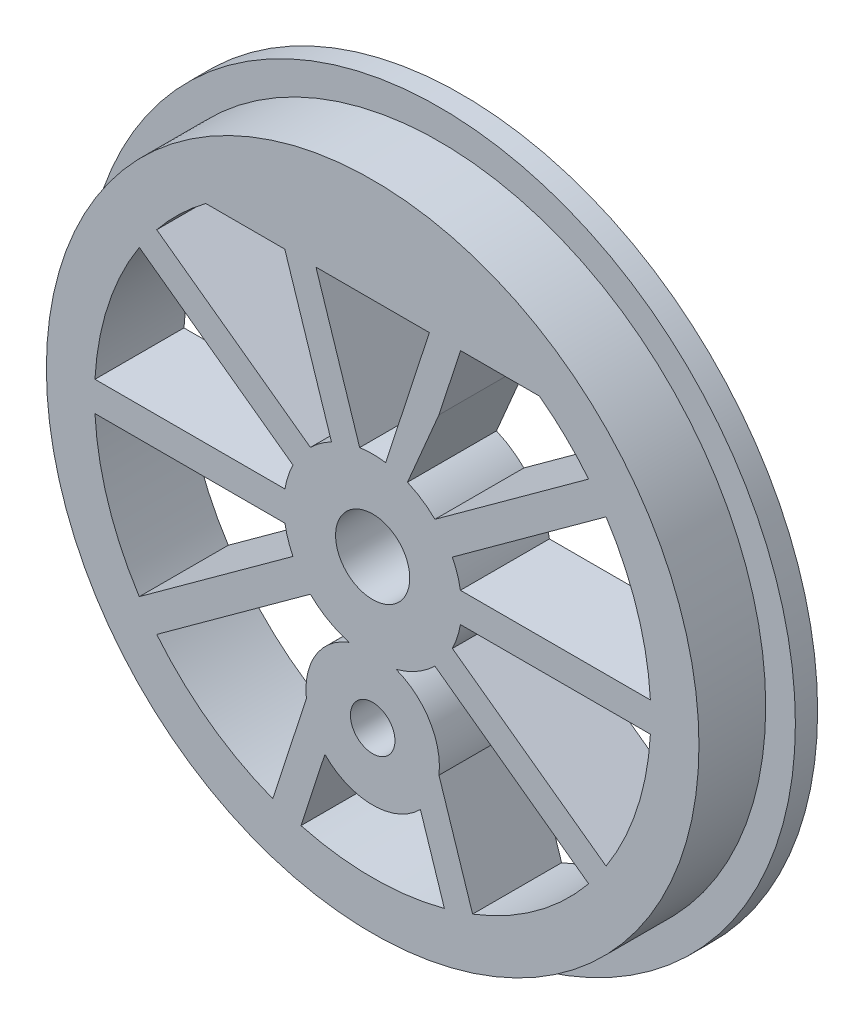
from build123d import *

# Parameters (mm, degrees)
ESQUISSE1_R        = 6
ESQUISSE1_R_2      = 2.5
ESQUISSE1_R_3      = 1.5
BOSS_EXTRU_1_DEPTH = 6
ESQUISSE4_R        = 24
ESQUISSE4_R_2      = 22
BOSS_EXTRU_3_DEPTH = 1.5


with BuildPart() as part:
    # Esquisse1 → Boss.-Extru.1 (new body)
    # profile 1 of 57: a face of its own
    with BuildSketch(Plane.XY):
        Circle(ESQUISSE1_R)
        Circle(ESQUISSE1_R_2, mode=Mode.SUBTRACT)
    # profile 2 of 57: a face of its own
    with BuildSketch(Plane.XY):
        with BuildLine():
            ThreePointArc((4.469792035, -10.520537382), (3.841677281, -7.656601684), (1.582669817, -5.7875))
            ThreePointArc((1.582669817, -5.7875), (0, -6), (-1.582669817, -5.7875))
            ThreePointArc((-1.582669817, -5.7875), (-3.841677281, -7.656601684), (-4.469792035, -10.520537382))
            ThreePointArc((-4.469792035, -10.520537382), (-4.06221109, -11.936089115), (-3.219339867, -13.144177288))
            ThreePointArc((-3.219339867, -13.144177288), (0, -14.5), (3.219339867, -13.144177288))
            ThreePointArc((3.219339867, -13.144177288), (4.06221109, -11.936089115), (4.469792035, -10.520537382))
        make_face()
        with Locations((0, -10)):
            Circle(ESQUISSE1_R_3, mode=Mode.SUBTRACT)
    # profile 3 of 57: a face of its own
    with BuildSketch(Plane.XY):
        with BuildLine():
            ThreePointArc((4.834765807, -18.115947107), (5.794068645, -17.832309681), (6.736878839, -17.497913119))
            Line((6.736878839, -17.497913119), (4.469792035, -10.520537382))
            ThreePointArc((4.469792035, -10.520537382), (4.06221109, -11.936089115), (3.219339867, -13.144177288))
            Line((3.219339867, -13.144177288), (4.834765807, -18.115947107))
        make_face()
    # profile 4 of 57: a face of its own
    with BuildSketch(Plane.XY):
        with BuildLine():
            ThreePointArc((-3.219339867, -13.144177288), (-4.06221109, -11.936089115), (-4.469792035, -10.520537382))
            Line((-4.469792035, -10.520537382), (-6.736878839, -17.497913119))
            ThreePointArc((-6.736878839, -17.497913119), (-5.794068645, -17.832309681), (-4.834765807, -18.115947107))
            Line((-4.834765807, -18.115947107), (-3.219339867, -13.144177288))
        make_face()
    # profile 5 of 57: a face of its own
    with BuildSketch(Plane.XY):
        with BuildLine():
            Line((-14.559694243, -11.814305039), (-4.198423832, -4.286401442))
            ThreePointArc((-4.198423832, -4.286401442), (-4.854101966, -3.526711514), (-5.373994337, -2.668367454))
            Line((-5.373994337, -2.668367454), (-15.735264747, -10.196271051))
            ThreePointArc((-15.735264747, -10.196271051), (-15.169068645, -11.02097348), (-14.559694243, -11.814305039))
        make_face()
    # profile 6 of 57: a face of its own
    with BuildSketch(Plane.XY):
        with BuildLine():
            Line((-18.723314343, -1), (-5.916079783, -1))
            ThreePointArc((-5.916079783, -1), (-6, 0), (-5.916079783, 1))
            Line((-5.916079783, 1), (-18.723314343, 1))
            ThreePointArc((-18.723314343, 1), (-18.75, 0), (-18.723314343, -1))
        make_face()
    # profile 7 of 57: a face of its own
    with BuildSketch(Plane.XY):
        with BuildLine():
            Line((-15.735264747, 10.196271051), (-5.373994337, 2.668367454))
            ThreePointArc((-5.373994337, 2.668367454), (-4.854101966, 3.526711514), (-4.198423832, 4.286401442))
            Line((-4.198423832, 4.286401442), (-14.559694243, 11.814305039))
            ThreePointArc((-14.559694243, 11.814305039), (-15.169068645, 11.02097348), (-15.735264747, 10.196271051))
        make_face()
    # profile 8 of 57: a face of its own
    with BuildSketch(Plane.XY):
        with BuildLine():
            ThreePointArc((-2.779225709, 5.317509234), (-1.854101966, 5.706339098), (-0.877112677, 5.935543223))
            Line((-0.877112677, 5.935543223), (-3.219339867, 13.144177288))
            Line((-3.219339867, 13.144177288), (-3.822333219, 15))
            Line((-3.822333219, 15), (-5.925257668, 15))
            Line((-5.925257668, 15), (-4.469792035, 10.520537382))
            Line((-4.469792035, 10.520537382), (-2.779225709, 5.317509234))
        make_face()
    # profile 9 of 57: a face of its own
    with BuildSketch(Plane.XY):
        with BuildLine():
            ThreePointArc((0.877112677, 5.935543223), (1.624852602, 5.775798994), (2.346205228, 5.522256878))
            Line((2.346205228, 5.522256878), (4.469792035, 10.520537382))
            Line((4.469792035, 10.520537382), (5.925257668, 15))
            Line((5.925257668, 15), (3.822333219, 15))
            Line((3.822333219, 15), (3.219339867, 13.144177288))
            Line((3.219339867, 13.144177288), (0.877112677, 5.935543223))
        make_face()
    # profile 10 of 57: a face of its own
    with BuildSketch(Plane.XY):
        with BuildLine():
            ThreePointArc((4.198423832, 4.286401442), (4.854101966, 3.526711514), (5.373994337, 2.668367454))
            Line((5.373994337, 2.668367454), (15.735264747, 10.196271051))
            ThreePointArc((15.735264747, 10.196271051), (15.169068645, 11.02097348), (14.559694243, 11.814305039))
            Line((14.559694243, 11.814305039), (4.198423832, 4.286401442))
        make_face()
    # profile 11 of 57: a face of its own
    with BuildSketch(Plane.XY):
        with BuildLine():
            ThreePointArc((6, 0), (5.978983137, -0.501757562), (5.916079783, -1))
            Line((5.916079783, -1), (18.723314343, -1))
            ThreePointArc((18.723314343, -1), (18.743327399, -0.500177999), (18.75, 0))
            ThreePointArc((18.75, 0), (18.743327399, 0.500177999), (18.723314343, 1))
            Line((18.723314343, 1), (5.916079783, 1))
            ThreePointArc((5.916079783, 1), (5.978983137, 0.501757562), (6, 0))
        make_face()
    # profile 12 of 57: a face of its own
    with BuildSketch(Plane.XY):
        with BuildLine():
            Line((15.735264747, -10.196271051), (5.373994337, -2.668367454))
            ThreePointArc((5.373994337, -2.668367454), (4.854101966, -3.526711514), (4.198423832, -4.286401442))
            Line((4.198423832, -4.286401442), (14.559694243, -11.814305039))
            ThreePointArc((14.559694243, -11.814305039), (15.169068645, -11.02097348), (15.735264747, -10.196271051))
        make_face()
    # profile 13 of 57: a face of its own
    with BuildSketch(Plane.XY):
        with BuildLine():
            ThreePointArc((-6.968959178, -18.212182955), (-11.46181242, -15.77583139), (-15.167288456, -12.255748075))
            Line((-15.167288456, -12.255748075), (-17.192192367, -13.726926882))
            ThreePointArc((-17.192192367, -13.726926882), (-12.93127555, -17.798373876), (-7.742403648, -20.592600267))
            Line((-7.742403648, -20.592600267), (-6.968959178, -18.212182955))
        make_face()
    # profile 14 of 57: a face of its own
    with BuildSketch(Plane.XY):
        with BuildLine():
            Line((-17.192192367, -13.726926882), (-15.167288456, -12.255748075))
            ThreePointArc((-15.167288456, -12.255748075), (-15.77583139, -11.46181242), (-16.342858961, -10.637714087))
            Line((-16.342858961, -10.637714087), (-18.367762872, -12.108892893))
            ThreePointArc((-18.367762872, -12.108892893), (-17.798373876, -12.93127555), (-17.192192367, -13.726926882))
        make_face()
    # profile 15 of 57: a face of its own
    with BuildSketch(Plane.XY):
        with BuildLine():
            Line((-18.367762872, -12.108892893), (-16.342858961, -10.637714087))
            ThreePointArc((-16.342858961, -10.637714087), (-18.545602068, -6.02583139), (-19.474342094, -1))
            Line((-19.474342094, -1), (-21.977260976, -1))
            ThreePointArc((-21.977260976, -1), (-20.923243358, -6.798373876), (-18.367762872, -12.108892893))
        make_face()
    # profile 16 of 57: a face of its own
    with BuildSketch(Plane.XY):
        with BuildLine():
            Line((-21.977260976, -1), (-19.474342094, -1))
            ThreePointArc((-19.474342094, -1), (-19.5, 0), (-19.474342094, 1))
            Line((-19.474342094, 1), (-21.977260976, 1))
            ThreePointArc((-21.977260976, 1), (-22, 0), (-21.977260976, -1))
        make_face()
    # profile 17 of 57: a face of its own
    with BuildSketch(Plane.XY):
        with BuildLine():
            Line((-21.977260976, 1), (-19.474342094, 1))
            ThreePointArc((-19.474342094, 1), (-18.545602068, 6.02583139), (-16.342858961, 10.637714087))
            Line((-16.342858961, 10.637714087), (-18.367762872, 12.108892893))
            ThreePointArc((-18.367762872, 12.108892893), (-20.923243358, 6.798373876), (-21.977260976, 1))
        make_face()
    # profile 18 of 57: a face of its own
    with BuildSketch(Plane.XY):
        with BuildLine():
            Line((-18.367762872, 12.108892893), (-16.342858961, 10.637714087))
            ThreePointArc((-16.342858961, 10.637714087), (-15.77583139, 11.46181242), (-15.167288456, 12.255748075))
            Line((-15.167288456, 12.255748075), (-17.192192367, 13.726926882))
            ThreePointArc((-17.192192367, 13.726926882), (-17.798373876, 12.93127555), (-18.367762872, 12.108892893))
        make_face()
    # profile 19 of 57: a face of its own
    with BuildSketch(Plane.XY):
        with BuildLine():
            ThreePointArc((-15.167288456, 12.255748075), (-11.46181242, 15.77583139), (-6.968959178, 18.212182955))
            Line((-6.968959178, 18.212182955), (-7.742403648, 20.592600267))
            ThreePointArc((-7.742403648, 20.592600267), (-12.93127555, 17.798373876), (-17.192192367, 13.726926882))
            Line((-17.192192367, 13.726926882), (-15.167288456, 12.255748075))
        make_face()
    # profile 20 of 57: a face of its own
    with BuildSketch(Plane.XY):
        with BuildLine():
            ThreePointArc((-6.968959178, 18.212182955), (-6.02583139, 18.545602068), (-5.066846145, 18.830216944))
            Line((-5.066846145, 18.830216944), (-5.840290615, 21.210634256))
            ThreePointArc((-5.840290615, 21.210634256), (-6.798373876, 20.923243358), (-7.742403648, 20.592600267))
            Line((-7.742403648, 20.592600267), (-6.968959178, 18.212182955))
        make_face()
    # profile 21 of 57: a face of its own
    with BuildSketch(Plane.XY):
        with BuildLine():
            Line((-11.25, 15), (-5.925257668, 15))
            Line((-5.925257668, 15), (-6.736878839, 17.497913119))
            ThreePointArc((-6.736878839, 17.497913119), (-9.079749175, 16.404897285), (-11.25, 15))
        make_face()
    # profile 22 of 57: a face of its own
    with BuildSketch(Plane.XY):
        with BuildLine():
            Line((-15.167288456, 12.255748075), (-14.559694243, 11.814305039))
            ThreePointArc((-14.559694243, 11.814305039), (-13.002778254, 13.508895502), (-11.25, 15))
            ThreePointArc((-11.25, 15), (-9.079749175, 16.404897285), (-6.736878839, 17.497913119))
            Line((-6.736878839, 17.497913119), (-6.968959178, 18.212182955))
            ThreePointArc((-6.968959178, 18.212182955), (-11.46181242, 15.77583139), (-15.167288456, 12.255748075))
        make_face()
    # profile 23 of 57: a face of its own
    with BuildSketch(Plane.XY):
        with BuildLine():
            Line((-16.342858961, 10.637714087), (-15.735264747, 10.196271051))
            ThreePointArc((-15.735264747, 10.196271051), (-15.169068645, 11.02097348), (-14.559694243, 11.814305039))
            Line((-14.559694243, 11.814305039), (-15.167288456, 12.255748075))
            ThreePointArc((-15.167288456, 12.255748075), (-15.77583139, 11.46181242), (-16.342858961, 10.637714087))
        make_face()
    # profile 24 of 57: a face of its own
    with BuildSketch(Plane.XY):
        with BuildLine():
            Line((-4.834765807, 18.115947107), (-5.066846145, 18.830216944))
            ThreePointArc((-5.066846145, 18.830216944), (-6.02583139, 18.545602068), (-6.968959178, 18.212182955))
            Line((-6.968959178, 18.212182955), (-6.736878839, 17.497913119))
            ThreePointArc((-6.736878839, 17.497913119), (-5.794068645, 17.832309681), (-4.834765807, 18.115947107))
        make_face()
    # profile 25 of 57: a face of its own
    with BuildSketch(Plane.XY):
        with BuildLine():
            Line((-5.925257668, 15), (-3.822333219, 15))
            Line((-3.822333219, 15), (-4.834765807, 18.115947107))
            ThreePointArc((-4.834765807, 18.115947107), (-5.794068645, 17.832309681), (-6.736878839, 17.497913119))
            Line((-6.736878839, 17.497913119), (-5.925257668, 15))
        make_face()
    # profile 26 of 57: a face of its own
    with BuildSketch(Plane.XY):
        with BuildLine():
            Line((-3.822333219, 15), (3.822333219, 15))
            Line((3.822333219, 15), (4.834765807, 18.115947107))
            ThreePointArc((4.834765807, 18.115947107), (0, 18.75), (-4.834765807, 18.115947107))
            Line((-4.834765807, 18.115947107), (-3.822333219, 15))
        make_face()
    # profile 27 of 57: a face of its own
    with BuildSketch(Plane.XY):
        with BuildLine():
            Line((4.834765807, 18.115947107), (5.066846145, 18.830216944))
            ThreePointArc((5.066846145, 18.830216944), (0, 19.5), (-5.066846145, 18.830216944))
            Line((-5.066846145, 18.830216944), (-4.834765807, 18.115947107))
            ThreePointArc((-4.834765807, 18.115947107), (0, 18.75), (4.834765807, 18.115947107))
        make_face()
    # profile 28 of 57: a face of its own
    with BuildSketch(Plane.XY):
        with BuildLine():
            Line((3.822333219, 15), (5.925257668, 15))
            Line((5.925257668, 15), (6.736878839, 17.497913119))
            ThreePointArc((6.736878839, 17.497913119), (5.794068645, 17.832309681), (4.834765807, 18.115947107))
            Line((4.834765807, 18.115947107), (3.822333219, 15))
        make_face()
    # profile 29 of 57: a face of its own
    with BuildSketch(Plane.XY):
        with BuildLine():
            Line((6.736878839, 17.497913119), (6.968959178, 18.212182955))
            ThreePointArc((6.968959178, 18.212182955), (6.02583139, 18.545602068), (5.066846145, 18.830216944))
            Line((5.066846145, 18.830216944), (4.834765807, 18.115947107))
            ThreePointArc((4.834765807, 18.115947107), (5.794068645, 17.832309681), (6.736878839, 17.497913119))
        make_face()
    # profile 30 of 57: a face of its own
    with BuildSketch(Plane.XY):
        with BuildLine():
            ThreePointArc((11.25, 15), (13.002778254, 13.508895502), (14.559694243, 11.814305039))
            Line((14.559694243, 11.814305039), (15.167288456, 12.255748075))
            ThreePointArc((15.167288456, 12.255748075), (11.46181242, 15.77583139), (6.968959178, 18.212182955))
            Line((6.968959178, 18.212182955), (6.736878839, 17.497913119))
            ThreePointArc((6.736878839, 17.497913119), (9.079749175, 16.404897285), (11.25, 15))
        make_face()
    # profile 31 of 57: a face of its own
    with BuildSketch(Plane.XY):
        with BuildLine():
            Line((5.925257668, 15), (11.25, 15))
            ThreePointArc((11.25, 15), (9.079749175, 16.404897285), (6.736878839, 17.497913119))
            Line((6.736878839, 17.497913119), (5.925257668, 15))
        make_face()
    # profile 32 of 57: a face of its own
    with BuildSketch(Plane.XY):
        with BuildLine():
            ThreePointArc((6.968959178, 18.212182955), (11.46181242, 15.77583139), (15.167288456, 12.255748075))
            Line((15.167288456, 12.255748075), (17.192192367, 13.726926882))
            ThreePointArc((17.192192367, 13.726926882), (12.93127555, 17.798373876), (7.742403648, 20.592600267))
            Line((7.742403648, 20.592600267), (6.968959178, 18.212182955))
        make_face()
    # profile 33 of 57: a face of its own
    with BuildSketch(Plane.XY):
        with BuildLine():
            ThreePointArc((5.066846145, 18.830216944), (6.02583139, 18.545602068), (6.968959178, 18.212182955))
            Line((6.968959178, 18.212182955), (7.742403648, 20.592600267))
            ThreePointArc((7.742403648, 20.592600267), (6.798373876, 20.923243358), (5.840290615, 21.210634256))
            Line((5.840290615, 21.210634256), (5.066846145, 18.830216944))
        make_face()
    # profile 34 of 57: a face of its own
    with BuildSketch(Plane.XY):
        with BuildLine():
            ThreePointArc((15.167288456, 12.255748075), (15.77583139, 11.46181242), (16.342858961, 10.637714087))
            Line((16.342858961, 10.637714087), (18.367762872, 12.108892893))
            ThreePointArc((18.367762872, 12.108892893), (17.798373876, 12.93127555), (17.192192367, 13.726926882))
            Line((17.192192367, 13.726926882), (15.167288456, 12.255748075))
        make_face()
    # profile 35 of 57: a face of its own
    with BuildSketch(Plane.XY):
        with BuildLine():
            ThreePointArc((16.342858961, 10.637714087), (18.545602068, 6.02583139), (19.474342094, 1))
            Line((19.474342094, 1), (21.977260976, 1))
            ThreePointArc((21.977260976, 1), (20.923243358, 6.798373876), (18.367762872, 12.108892893))
            Line((18.367762872, 12.108892893), (16.342858961, 10.637714087))
        make_face()
    # profile 36 of 57: a face of its own
    with BuildSketch(Plane.XY):
        with BuildLine():
            ThreePointArc((-5.066846145, 18.830216944), (0, 19.5), (5.066846145, 18.830216944))
            Line((5.066846145, 18.830216944), (5.840290615, 21.210634256))
            ThreePointArc((5.840290615, 21.210634256), (0, 22), (-5.840290615, 21.210634256))
            Line((-5.840290615, 21.210634256), (-5.066846145, 18.830216944))
        make_face()
    # profile 37 of 57: a face of its own
    with BuildSketch(Plane.XY):
        with BuildLine():
            ThreePointArc((19.5, 0), (19.493584468, -0.500164555), (19.474342094, -1))
            Line((19.474342094, -1), (21.977260976, -1))
            ThreePointArc((21.977260976, -1), (21.994314509, -0.500129249), (22, 0))
            ThreePointArc((22, 0), (21.994314509, 0.500129249), (21.977260976, 1))
            Line((21.977260976, 1), (19.474342094, 1))
            ThreePointArc((19.474342094, 1), (19.493584468, 0.500164555), (19.5, 0))
        make_face()
    # profile 38 of 57: a face of its own
    with BuildSketch(Plane.XY):
        with BuildLine():
            ThreePointArc((18.75, 0), (18.743327399, -0.500177999), (18.723314343, -1))
            Line((18.723314343, -1), (19.474342094, -1))
            ThreePointArc((19.474342094, -1), (19.493584468, -0.500164555), (19.5, 0))
            ThreePointArc((19.5, 0), (19.493584468, 0.500164555), (19.474342094, 1))
            Line((19.474342094, 1), (18.723314343, 1))
            ThreePointArc((18.723314343, 1), (18.743327399, 0.500177999), (18.75, 0))
        make_face()
    # profile 39 of 57: a face of its own
    with BuildSketch(Plane.XY):
        with BuildLine():
            ThreePointArc((15.735264747, 10.196271051), (17.832309681, 5.794068645), (18.723314343, 1))
            Line((18.723314343, 1), (19.474342094, 1))
            ThreePointArc((19.474342094, 1), (18.545602068, 6.02583139), (16.342858961, 10.637714087))
            Line((16.342858961, 10.637714087), (15.735264747, 10.196271051))
        make_face()
    # profile 40 of 57: a face of its own
    with BuildSketch(Plane.XY):
        with BuildLine():
            ThreePointArc((14.559694243, 11.814305039), (15.169068645, 11.02097348), (15.735264747, 10.196271051))
            Line((15.735264747, 10.196271051), (16.342858961, 10.637714087))
            ThreePointArc((16.342858961, 10.637714087), (15.77583139, 11.46181242), (15.167288456, 12.255748075))
            Line((15.167288456, 12.255748075), (14.559694243, 11.814305039))
        make_face()
    # profile 41 of 57: a face of its own
    with BuildSketch(Plane.XY):
        with BuildLine():
            ThreePointArc((19.474342094, -1), (18.545602068, -6.02583139), (16.342858961, -10.637714087))
            Line((16.342858961, -10.637714087), (18.367762872, -12.108892893))
            ThreePointArc((18.367762872, -12.108892893), (20.923243358, -6.798373876), (21.977260976, -1))
            Line((21.977260976, -1), (19.474342094, -1))
        make_face()
    # profile 42 of 57: a face of its own
    with BuildSketch(Plane.XY):
        with BuildLine():
            ThreePointArc((18.723314343, -1), (17.832309681, -5.794068645), (15.735264747, -10.196271051))
            Line((15.735264747, -10.196271051), (16.342858961, -10.637714087))
            ThreePointArc((16.342858961, -10.637714087), (18.545602068, -6.02583139), (19.474342094, -1))
            Line((19.474342094, -1), (18.723314343, -1))
        make_face()
    # profile 43 of 57: a face of its own
    with BuildSketch(Plane.XY):
        with BuildLine():
            Line((18.367762872, -12.108892893), (16.342858961, -10.637714087))
            ThreePointArc((16.342858961, -10.637714087), (15.77583139, -11.46181242), (15.167288456, -12.255748075))
            Line((15.167288456, -12.255748075), (17.192192367, -13.726926882))
            ThreePointArc((17.192192367, -13.726926882), (17.798373876, -12.93127555), (18.367762872, -12.108892893))
        make_face()
    # profile 44 of 57: a face of its own
    with BuildSketch(Plane.XY):
        with BuildLine():
            Line((16.342858961, -10.637714087), (15.735264747, -10.196271051))
            ThreePointArc((15.735264747, -10.196271051), (15.169068645, -11.02097348), (14.559694243, -11.814305039))
            Line((14.559694243, -11.814305039), (15.167288456, -12.255748075))
            ThreePointArc((15.167288456, -12.255748075), (15.77583139, -11.46181242), (16.342858961, -10.637714087))
        make_face()
    # profile 45 of 57: a face of its own
    with BuildSketch(Plane.XY):
        with BuildLine():
            Line((17.192192367, -13.726926882), (15.167288456, -12.255748075))
            ThreePointArc((15.167288456, -12.255748075), (11.46181242, -15.77583139), (6.968959178, -18.212182955))
            Line((6.968959178, -18.212182955), (7.742403648, -20.592600267))
            ThreePointArc((7.742403648, -20.592600267), (12.93127555, -17.798373876), (17.192192367, -13.726926882))
        make_face()
    # profile 46 of 57: a face of its own
    with BuildSketch(Plane.XY):
        with BuildLine():
            Line((15.167288456, -12.255748075), (14.559694243, -11.814305039))
            ThreePointArc((14.559694243, -11.814305039), (11.02097348, -15.169068645), (6.736878839, -17.497913119))
            Line((6.736878839, -17.497913119), (6.968959178, -18.212182955))
            ThreePointArc((6.968959178, -18.212182955), (11.46181242, -15.77583139), (15.167288456, -12.255748075))
        make_face()
    # profile 47 of 57: a face of its own
    with BuildSketch(Plane.XY):
        with BuildLine():
            Line((7.742403648, -20.592600267), (6.968959178, -18.212182955))
            ThreePointArc((6.968959178, -18.212182955), (6.02583139, -18.545602068), (5.066846145, -18.830216944))
            Line((5.066846145, -18.830216944), (5.840290615, -21.210634256))
            ThreePointArc((5.840290615, -21.210634256), (6.798373876, -20.923243358), (7.742403648, -20.592600267))
        make_face()
    # profile 48 of 57: a face of its own
    with BuildSketch(Plane.XY):
        with BuildLine():
            Line((6.968959178, -18.212182955), (6.736878839, -17.497913119))
            ThreePointArc((6.736878839, -17.497913119), (5.794068645, -17.832309681), (4.834765807, -18.115947107))
            Line((4.834765807, -18.115947107), (5.066846145, -18.830216944))
            ThreePointArc((5.066846145, -18.830216944), (6.02583139, -18.545602068), (6.968959178, -18.212182955))
        make_face()
    # profile 49 of 57: a face of its own
    with BuildSketch(Plane.XY):
        with BuildLine():
            Line((5.066846145, -18.830216944), (4.834765807, -18.115947107))
            ThreePointArc((4.834765807, -18.115947107), (0, -18.75), (-4.834765807, -18.115947107))
            Line((-4.834765807, -18.115947107), (-5.066846145, -18.830216944))
            ThreePointArc((-5.066846145, -18.830216944), (0, -19.5), (5.066846145, -18.830216944))
        make_face()
    # profile 50 of 57: a face of its own
    with BuildSketch(Plane.XY):
        with BuildLine():
            Line((5.840290615, -21.210634256), (5.066846145, -18.830216944))
            ThreePointArc((5.066846145, -18.830216944), (0, -19.5), (-5.066846145, -18.830216944))
            Line((-5.066846145, -18.830216944), (-5.840290615, -21.210634256))
            ThreePointArc((-5.840290615, -21.210634256), (0, -22), (5.840290615, -21.210634256))
        make_face()
    # profile 51 of 57: a face of its own
    with BuildSketch(Plane.XY):
        with BuildLine():
            Line((-5.066846145, -18.830216944), (-4.834765807, -18.115947107))
            ThreePointArc((-4.834765807, -18.115947107), (-5.794068645, -17.832309681), (-6.736878839, -17.497913119))
            Line((-6.736878839, -17.497913119), (-6.968959178, -18.212182955))
            ThreePointArc((-6.968959178, -18.212182955), (-6.02583139, -18.545602068), (-5.066846145, -18.830216944))
        make_face()
    # profile 52 of 57: a face of its own
    with BuildSketch(Plane.XY):
        with BuildLine():
            ThreePointArc((-6.736878839, -17.497913119), (-11.02097348, -15.169068645), (-14.559694243, -11.814305039))
            Line((-14.559694243, -11.814305039), (-15.167288456, -12.255748075))
            ThreePointArc((-15.167288456, -12.255748075), (-11.46181242, -15.77583139), (-6.968959178, -18.212182955))
            Line((-6.968959178, -18.212182955), (-6.736878839, -17.497913119))
        make_face()
    # profile 53 of 57: a face of its own
    with BuildSketch(Plane.XY):
        with BuildLine():
            Line((-15.167288456, -12.255748075), (-14.559694243, -11.814305039))
            ThreePointArc((-14.559694243, -11.814305039), (-15.169068645, -11.02097348), (-15.735264747, -10.196271051))
            Line((-15.735264747, -10.196271051), (-16.342858961, -10.637714087))
            ThreePointArc((-16.342858961, -10.637714087), (-15.77583139, -11.46181242), (-15.167288456, -12.255748075))
        make_face()
    # profile 54 of 57: a face of its own
    with BuildSketch(Plane.XY):
        with BuildLine():
            Line((-19.474342094, 1), (-18.723314343, 1))
            ThreePointArc((-18.723314343, 1), (-17.832309681, 5.794068645), (-15.735264747, 10.196271051))
            Line((-15.735264747, 10.196271051), (-16.342858961, 10.637714087))
            ThreePointArc((-16.342858961, 10.637714087), (-18.545602068, 6.02583139), (-19.474342094, 1))
        make_face()
    # profile 55 of 57: a face of its own
    with BuildSketch(Plane.XY):
        with BuildLine():
            Line((-19.474342094, -1), (-18.723314343, -1))
            ThreePointArc((-18.723314343, -1), (-18.75, 0), (-18.723314343, 1))
            Line((-18.723314343, 1), (-19.474342094, 1))
            ThreePointArc((-19.474342094, 1), (-19.5, 0), (-19.474342094, -1))
        make_face()
    # profile 56 of 57: a face of its own
    with BuildSketch(Plane.XY):
        with BuildLine():
            Line((-16.342858961, -10.637714087), (-15.735264747, -10.196271051))
            ThreePointArc((-15.735264747, -10.196271051), (-17.832309681, -5.794068645), (-18.723314343, -1))
            Line((-18.723314343, -1), (-19.474342094, -1))
            ThreePointArc((-19.474342094, -1), (-18.545602068, -6.02583139), (-16.342858961, -10.637714087))
        make_face()
    # profile 57 of 57: a face of its own
    with BuildSketch(Plane.XY):
        with BuildLine():
            Line((-5.840290615, -21.210634256), (-5.066846145, -18.830216944))
            ThreePointArc((-5.066846145, -18.830216944), (-6.02583139, -18.545602068), (-6.968959178, -18.212182955))
            Line((-6.968959178, -18.212182955), (-7.742403648, -20.592600267))
            ThreePointArc((-7.742403648, -20.592600267), (-6.798373876, -20.923243358), (-5.840290615, -21.210634256))
        make_face()
    extrude(amount=BOSS_EXTRU_1_DEPTH)

    # Esquisse4 → Boss.-Extru.3 (add)
    with BuildSketch(Plane(origin=(0, 0, 0), x_dir=(-1, 0, 0), z_dir=(0, 0, -1))):
        Circle(ESQUISSE4_R)
        Circle(ESQUISSE4_R_2, mode=Mode.SUBTRACT)
    extrude(amount=-BOSS_EXTRU_3_DEPTH)


solid = part.part
